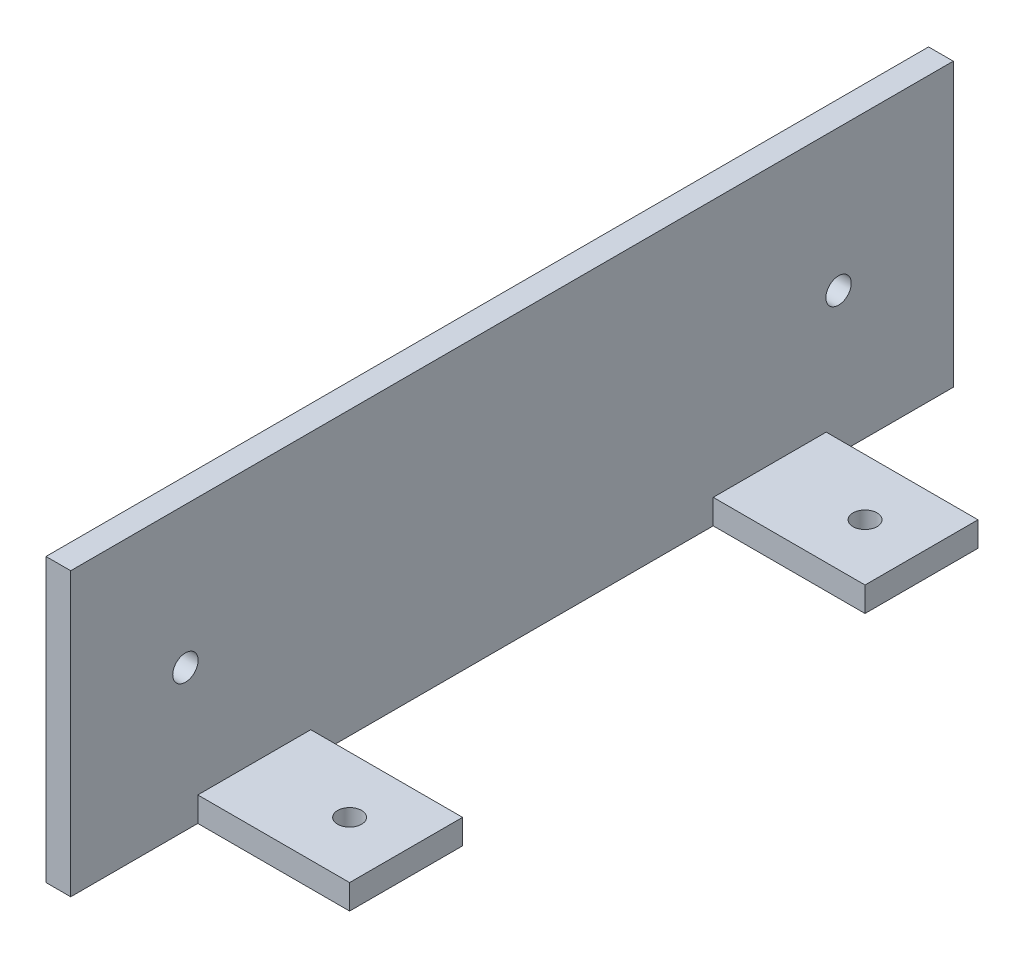
from build123d import *

# Parameters (mm, degrees)
BOSS_EXTRUDE3_DEPTH      = 62.5
BOSS_EXTRUDE3_DEPTH_BACK = 62.5
SKETCH4_R                = 1.8
CUT_EXTRUDE1_DEPTH       = 62.5
SKETCH5_R                = 1.8
CUT_EXTRUDE2_DEPTH       = 62.5
SKETCH7_W                = 21.5
SKETCH7_H                = 18
CUT_EXTRUDE5_DEPTH       = 62.5
SKETCH10_W               = 21.5
SKETCH10_H               = 18
CUT_EXTRUDE7_DEPTH       = 62.5
SKETCH13_W               = 21.5
SKETCH13_H               = 28.5
CUT_EXTRUDE9_DEPTH       = 62.5
SKETCH18_W               = 21.5
SKETCH18_H               = 28.5
CUT_EXTRUDE10_DEPTH      = 62.5
SKETCH20_R               = 1.7
CUT_EXTRUDE11_DEPTH      = 62.5
SKETCH21_R               = 1.7
CUT_EXTRUDE12_DEPTH      = 62.5


with BuildPart() as part:
    # Sketch1 → Boss-Extrude3 (new, two sides: drawn at the far end of the back side and taken through both)
    with BuildSketch(Plane.XY.offset(-BOSS_EXTRUDE3_DEPTH_BACK)):
        Polygon((0, 0), (0, 40), (3.5, 40), (3.5, 3.5), (25, 3.5), (25, 0), align=None)
    extrude(amount=BOSS_EXTRUDE3_DEPTH + BOSS_EXTRUDE3_DEPTH_BACK)

    # Sketch4 → Cut-Extrude1 (cut)
    with BuildSketch(Plane.ZY):
        with Locations((-46.25, 20)):
            Circle(SKETCH4_R)
    extrude(amount=-CUT_EXTRUDE1_DEPTH, mode=Mode.SUBTRACT)

    # Sketch5 → Cut-Extrude2 (cut)
    with BuildSketch(Plane.ZY):
        with Locations((46.25, 20)):
            Circle(SKETCH5_R)
    extrude(amount=-CUT_EXTRUDE2_DEPTH, mode=Mode.SUBTRACT)

    # Sketch7 → Cut-Extrude5 (cut)
    with BuildSketch(Plane(origin=(0, 3.5, 0), x_dir=(1, 0, 0), z_dir=(0, 1, 0))):
        with Locations((14.25, -53.5)):
            Rectangle(SKETCH7_W, SKETCH7_H)
    extrude(amount=-CUT_EXTRUDE5_DEPTH, mode=Mode.SUBTRACT)

    # Sketch10 → Cut-Extrude7 (cut)
    with BuildSketch(Plane(origin=(0, 3.5, 0), x_dir=(1, 0, 0), z_dir=(0, 1, 0))):
        with Locations((14.25, 53.5)):
            Rectangle(SKETCH10_W, SKETCH10_H)
    extrude(amount=-CUT_EXTRUDE7_DEPTH, mode=Mode.SUBTRACT)

    # Sketch13 → Cut-Extrude9 (cut)
    with BuildSketch(Plane(origin=(0, 3.5, 0), x_dir=(1, 0, 0), z_dir=(0, 1, 0))):
        with Locations((14.25, -14.25)):
            Rectangle(SKETCH13_W, SKETCH13_H)
    extrude(amount=-CUT_EXTRUDE9_DEPTH, mode=Mode.SUBTRACT)

    # Sketch18 → Cut-Extrude10 (cut)
    with BuildSketch(Plane(origin=(0, 3.5, 0), x_dir=(1, 0, 0), z_dir=(0, 1, 0))):
        with Locations((14.25, 14.25)):
            Rectangle(SKETCH18_W, SKETCH18_H)
    extrude(amount=-CUT_EXTRUDE10_DEPTH, mode=Mode.SUBTRACT)

    # Sketch20 → Cut-Extrude11 (cut)
    with BuildSketch(Plane(origin=(0, 3.5, 0), x_dir=(1, 0, 0), z_dir=(0, 1, 0))):
        with Locations((17, 36.5)):
            Circle(SKETCH20_R)
    extrude(amount=-CUT_EXTRUDE11_DEPTH, mode=Mode.SUBTRACT)

    # Sketch21 → Cut-Extrude12 (cut)
    with BuildSketch(Plane(origin=(0, 3.5, 0), x_dir=(1, 0, 0), z_dir=(0, 1, 0))):
        with Locations((17, -36.5)):
            Circle(SKETCH21_R)
    extrude(amount=-CUT_EXTRUDE12_DEPTH, mode=Mode.SUBTRACT)


solid = part.part
